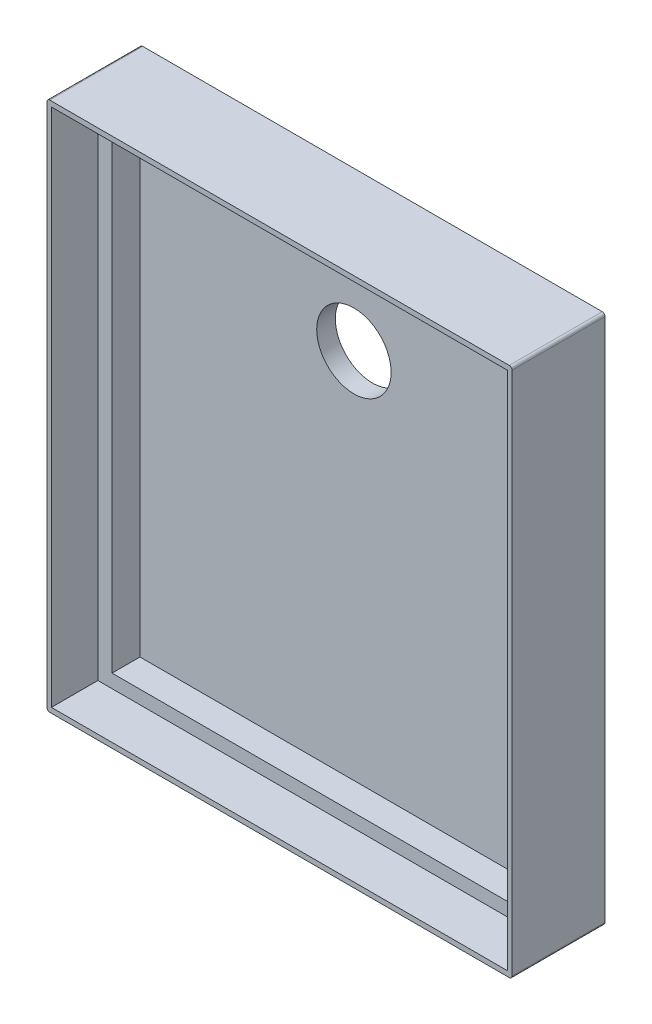
from build123d import *

# Parameters (mm, degrees)
EXTRUDE_1_DEPTH     = 100
SHELL_1_T           = -20
CUT_EXTRUDE_1_DEPTH = 50
SKETCH_3_R          = 60
CUT_EXTRUDE_2_DEPTH = 50
SKETCH_5_R          = 60
SKETCH_5_R_2        = 40
EXTRUDE_2_DEPTH     = 20


with BuildPart() as part:
    # 草图1 → 凸台-拉伸1 (new body)
    with BuildSketch(Plane.XY):
        with BuildLine():
            Line((3, 0), (497, 0))
            ThreePointArc((497, 0), (499.121320344, -0.878679656), (500, -3))
            Line((500, -3), (500, -567))
            ThreePointArc((500, -567), (499.121320344, -569.121320344), (497, -570))
            Line((497, -570), (3, -570))
            ThreePointArc((3, -570), (0.878679656, -569.121320344), (0, -567))
            Line((0, -567), (0, -3))
            ThreePointArc((0, -3), (0.878679656, -0.878679656), (3, 0))
        make_face()
    extrude(amount=EXTRUDE_1_DEPTH)

    # 抽壳1
    shell_1_openings = [part.faces().sort_by_distance(p)[0] for p in [
        (250, -285, 100),
    ]]
    offset(amount=SHELL_1_T, openings=shell_1_openings, kind=Kind.INTERSECTION)

    # 草图2 → 切除-拉伸1 (cut)
    with BuildSketch(Plane.XY.offset(100)):
        Polygon((4.785, -5.49), (495.215, -5.49), (495.215, -20), (495.215, -550), (495.215, -564.51), (4.785, -564.51), (4.785, -550), (4.785, -20), align=None)
    extrude(amount=-CUT_EXTRUDE_1_DEPTH, mode=Mode.SUBTRACT)

    # 草图3 → 切除-拉伸2 (cut)
    with BuildSketch(Plane(origin=(0, 0, 0), x_dir=(-1, 0, 0), z_dir=(0, 0, -1))):
        with Locations((-250, -150)):
            Circle(SKETCH_3_R)
    extrude(amount=-CUT_EXTRUDE_2_DEPTH, mode=Mode.SUBTRACT)

    # 草图5 → 凸台-拉伸2 (add)
    with BuildSketch(Plane(origin=(0, 0, 0), x_dir=(-1, 0, 0), z_dir=(0, 0, -1))):
        with Locations((-250, -150)):
            Circle(SKETCH_5_R)
        with Locations((-250, -150)):
            Circle(SKETCH_5_R_2, mode=Mode.SUBTRACT)
    extrude(amount=-EXTRUDE_2_DEPTH)


solid = part.part
